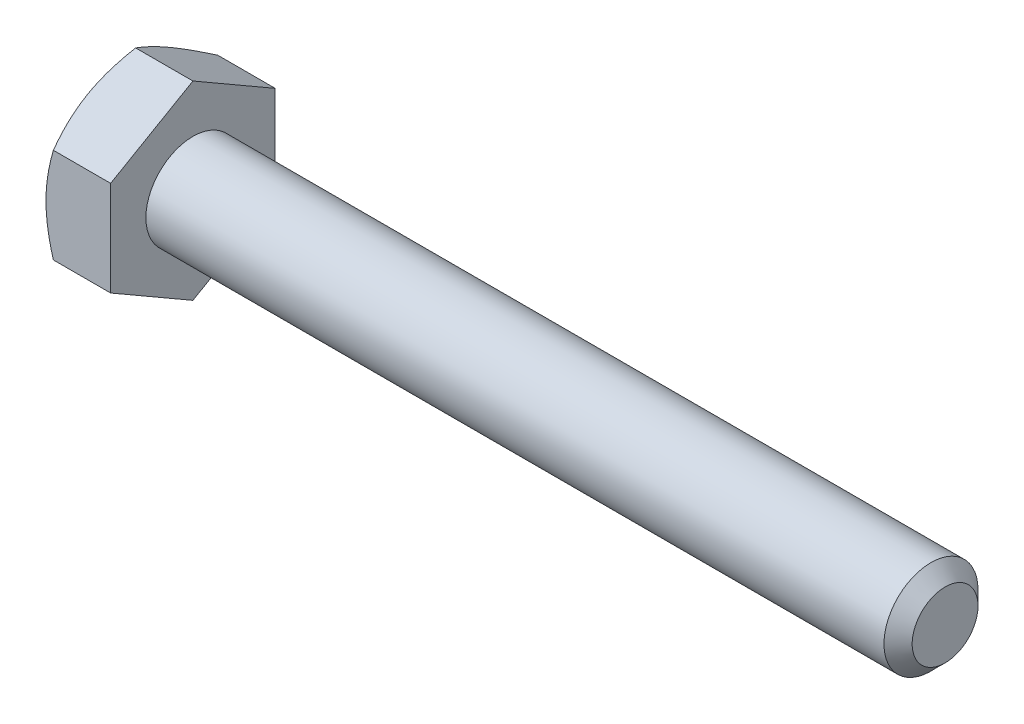
from build123d import *

# Parameters (mm, degrees)
SKETCH5_R           = 3.175
BOSS_EXTRUDE3_DEPTH = 50.8
CHAMFER1_SIZE       = 0.9525
BOSS_EXTRUDE4_DEPTH = 4.365625
SKETCH8_OUTSIDE_W   = 221.468
SKETCH8_OUTSIDE_H   = 223.188
SKETCH8_OUTSIDE_R   = 5.55625
CUT_EXTRUDE3_DEPTH  = 56.814699209
CUT_EXTRUDE3_DRAFT  = -60


with BuildPart() as part:
    # Sketch5 → Boss-Extrude3 (new body)
    with BuildSketch(Plane(origin=(27.5828125, 0, 0), x_dir=(0, 0, -1), z_dir=(1, 0, 0))):
        Circle(SKETCH5_R)
    extrude(amount=-BOSS_EXTRUDE3_DEPTH)

    # Chamfer1
    chamfer1_edges = [part.edges().sort_by_distance(p)[0] for p in [
        (27.5828125, 0, 3.175),
    ]]
    chamfer(chamfer1_edges, length=CHAMFER1_SIZE)

    # Sketch11 → Revolve1 (revolve)
    with BuildSketch(Plane.XY):
        Polygon((-23.2171875, 3.175), (-23.2171875, 0), (11.7078125, 0), (8.5328125, 3.175), align=None)
    revolve(axis=Axis((-23.2171875, 0, 0), (1, 0, 0)))

    # Sketch6 → Boss-Extrude4 (add)
    with BuildSketch(Plane.ZY.offset(23.2171875)):
        Polygon((5.55625, 3.207902433), (0, 6.415804866), (-5.55625, 3.207902433), (-5.55625, -3.207902433), (0, -6.415804866), (5.55625, -3.207902433), align=None)
    extrude(amount=BOSS_EXTRUDE4_DEPTH)


with BuildPart() as cut_extrude3_tool:
    # Sketch8 outside → Cut-Extrude3 (with draft: the straight prism first)
    with BuildSketch(Plane.ZY.offset(27.5828125)):
        Rectangle(SKETCH8_OUTSIDE_W, SKETCH8_OUTSIDE_H)
        Circle(SKETCH8_OUTSIDE_R, mode=Mode.SUBTRACT)
    extrude(amount=-CUT_EXTRUDE3_DEPTH)
    # Cut-Extrude3: the draft: its side faces are tilted about the plane it starts from
    cut_extrude3_sides = [cut_extrude3_tool.faces().sort_by_distance(p)[0] for p in [
        (0.824537104, -111.594, 0),
        (0.824537104, 0, 110.734),
        (0.824537104, 111.594, 0),
        (0.824537104, 0, -110.734),
        (0.824537104, 0, -5.55625),
    ]]
    draft(cut_extrude3_sides, Plane.ZY.offset(27.5828125), CUT_EXTRUDE3_DRAFT)


with BuildPart() as part_1:
    add(part.part)

    # Cut-Extrude3: cut by cut_extrude3_tool
    add(cut_extrude3_tool.part, mode=Mode.SUBTRACT)


solid = part_1.part
